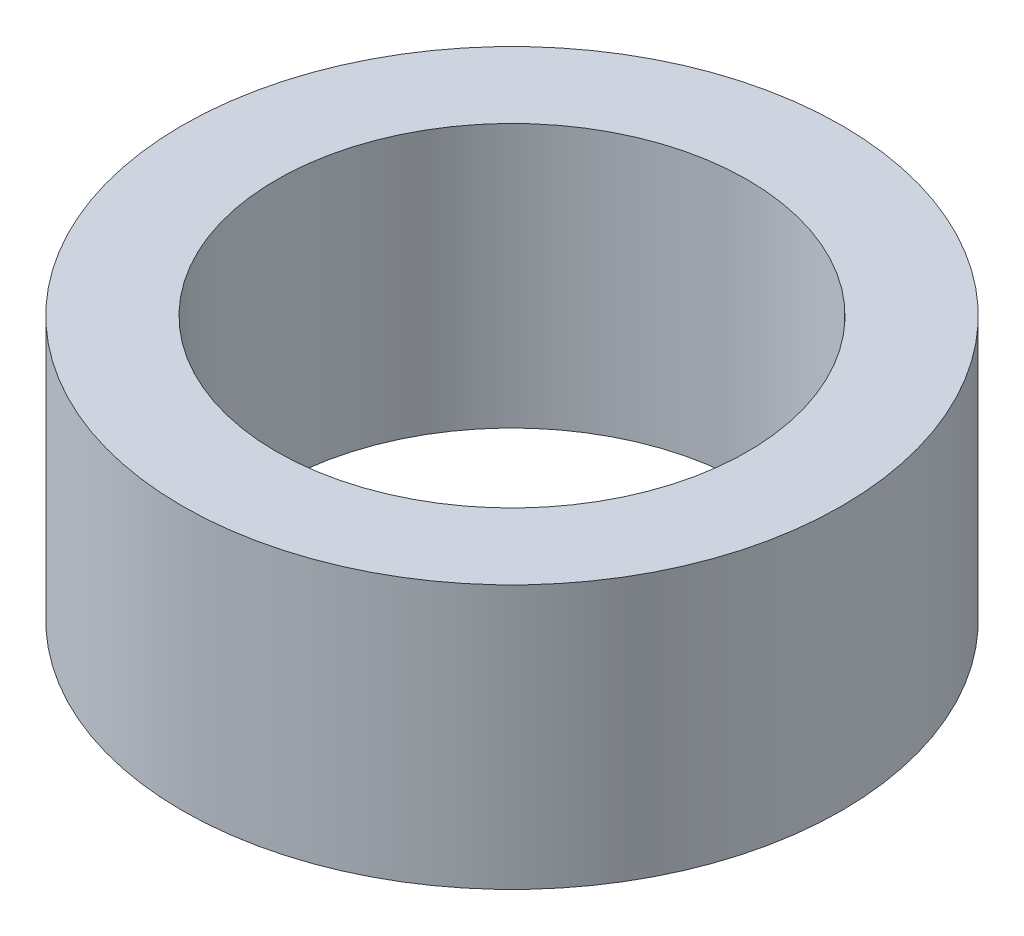
from build123d import *

# Parameters (mm, degrees)
SKETCH1_R           = 5.55625
SKETCH1_R_2         = 3.96875
BOSS_EXTRUDE1_DEPTH = 4.445


with BuildPart() as part:
    # Sketch1 → Boss-Extrude1 (new body)
    with BuildSketch(Plane(origin=(0, 0, 0), x_dir=(1, 0, 0), z_dir=(0, 1, 0))):
        with Locations(Location((0, 0, 0), (0, 0, 270))):
            Circle(SKETCH1_R)
        with Locations(Location((0, 0, 0), (0, 0, 270))):
            Circle(SKETCH1_R_2, mode=Mode.SUBTRACT)
    extrude(amount=-BOSS_EXTRUDE1_DEPTH)


solid = part.part
